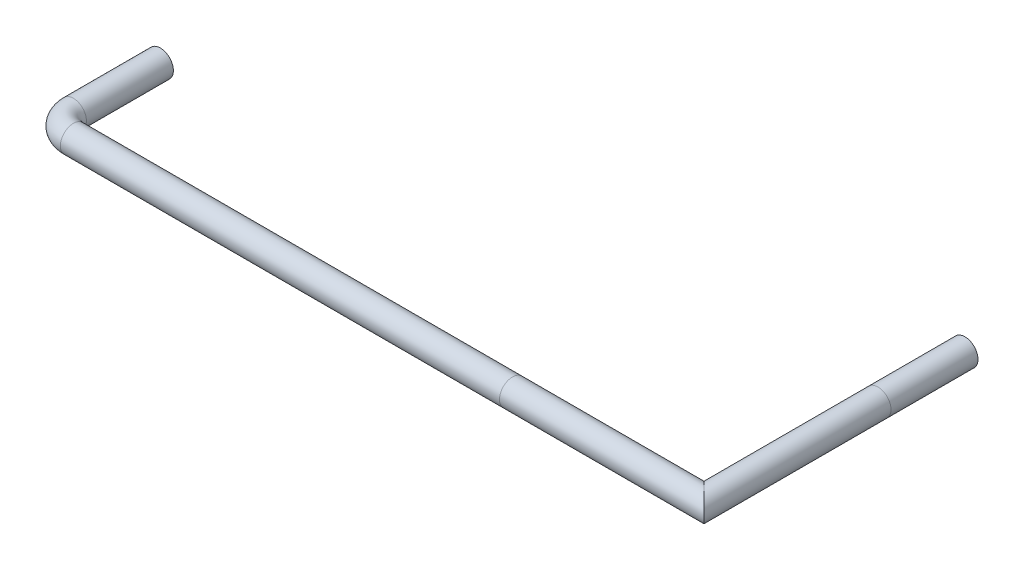
from build123d import *

# Parameters (mm, degrees)
SKETCH2_R = 0.6


with BuildPart() as part:
    # Sweep2: sweep along a path in Sketch1
    with BuildLine(Plane(origin=(0, 0, 0), x_dir=(1, 0, 0), z_dir=(0, 1, 0))) as sweep2_path:
        Line((-21.194599122, 5), (-21.194599122, 1))
        ThreePointArc((-21.194599122, 1), (-20.901705903, 0.292893219), (-20.194599122, 0))
        Line((-20.194599122, 0), (0, 0))
        Line((0, 0), (8.805400878, 0))
        Line((8.805400878, 0), (8.805400878, 8))
        Line((8.805400878, 8), (8.805400878, 12))
    # Sketch2 → Sweep2 (sweep)
    with BuildSketch(Plane(origin=(8.805400878, 0, -12), x_dir=(1, 0, 0), z_dir=(0, 0, 1))):
        Circle(SKETCH2_R)
    sweep(path=sweep2_path.line, transition=Transition.RIGHT)


solid = part.part
